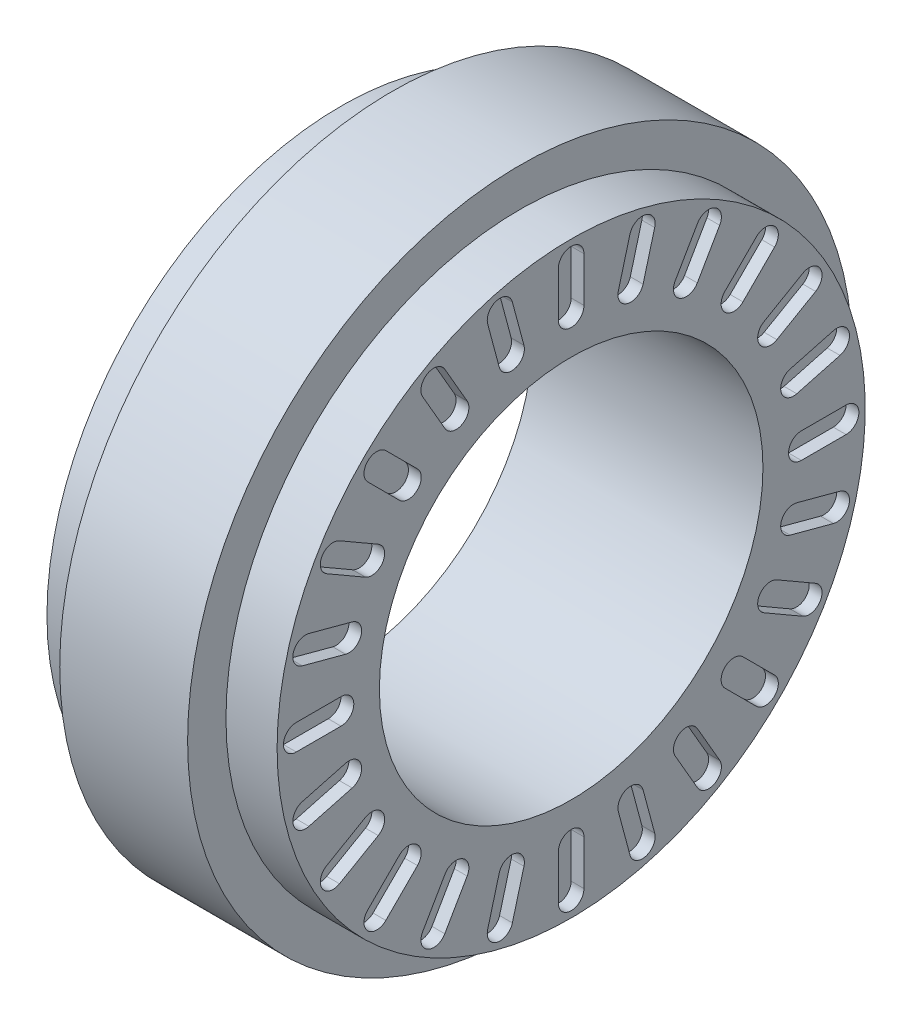
from build123d import *

# Parameters (mm, degrees)
CUT_EXTRUDE1_DEPTH    = 1
CIRPATTERN1_COUNT     = 24
MIRROR4_COPY_1_DEPTH  = 1
MIRROR4_COPY_2_DEPTH  = 1
MIRROR4_COPY_3_DEPTH  = 1
MIRROR4_COPY_4_DEPTH  = 1
MIRROR4_COPY_5_DEPTH  = 1
MIRROR4_COPY_6_DEPTH  = 1
MIRROR4_COPY_7_DEPTH  = 1
MIRROR4_COPY_8_DEPTH  = 1
MIRROR4_COPY_9_DEPTH  = 1
MIRROR4_COPY_10_DEPTH = 1
MIRROR4_COPY_11_DEPTH = 1
MIRROR4_COPY_12_DEPTH = 1
MIRROR4_COPY_13_DEPTH = 1
MIRROR4_COPY_14_DEPTH = 1
MIRROR4_COPY_15_DEPTH = 1
MIRROR4_COPY_16_DEPTH = 1
MIRROR4_COPY_17_DEPTH = 1
MIRROR4_COPY_18_DEPTH = 1
MIRROR4_COPY_19_DEPTH = 1
MIRROR4_COPY_20_DEPTH = 1
MIRROR4_COPY_21_DEPTH = 1
MIRROR4_COPY_22_DEPTH = 1
MIRROR4_COPY_23_DEPTH = 1


with BuildPart() as part:
    # Sketch3 → Revolve1 (revolve)
    with BuildSketch(Plane(origin=(0, 0, 0), x_dir=(1, 0, 0), z_dir=(0, 1, 0)), mode=Mode.PRIVATE) as revolve1_sk:
        Polygon((0, 15), (0, 26), (5, 26), (5, 23), (9, 23), (9, 15), align=None)
    revolve1 = revolve(revolve1_sk.sketch.rotate(Axis((0, 0, 0), (1, 0, 0)), 180), axis=Axis((0, 0, 0), (1, 0, 0)))

    # Mirror3: Revolve1 across plane
    add(revolve1.mirror(Plane(origin=(0, 0, -15), x_dir=(0, 0, 1), z_dir=(1, 0, 0))))

    # Sketch4 → Cut-Extrude1 (cut)
    with BuildSketch(Plane(origin=(9, 0, 0), x_dir=(0, 0, -1), z_dir=(1, 0, 0))):
        with BuildLine():
            Line((-1, 21.5), (-1, 18))
            ThreePointArc((-1, 18), (0, 17), (1, 18))
            Line((1, 18), (1, 21.5))
            ThreePointArc((1, 21.5), (0, 22.5), (-1, 21.5))
        make_face()
    cut_extrude1 = extrude(amount=-CUT_EXTRUDE1_DEPTH, mode=Mode.SUBTRACT)

    # CirPattern1: Cut-Extrude1 ×24 about axis
    cirpattern1_axis = Axis((0, 0, 0), (1, 0, 0))
    for i in range(1, CIRPATTERN1_COUNT):
        add(cut_extrude1.rotate(cirpattern1_axis, i * 360 / CIRPATTERN1_COUNT), mode=Mode.SUBTRACT)

    # Mirror4: Cut-Extrude1 across plane
    add(cut_extrude1.mirror(Plane(origin=(0, 0, 0), x_dir=(0, 0, 1), z_dir=(1, 0, 0))), mode=Mode.SUBTRACT)

    # Mirror4 copy 1 sketch → Mirror4 copy 1 (cut)
    with BuildSketch(Plane(origin=(-9, 0, 0), x_dir=(0, 0.25881904510252074, -0.9659258262890683), z_dir=(-1, 0, 0))):
        with BuildLine():
            Line((-1, -21.5), (-1, -18))
            ThreePointArc((-1, -18), (0, -17), (1, -18))
            Line((1, -18), (1, -21.5))
            ThreePointArc((1, -21.5), (0, -22.5), (-1, -21.5))
        make_face()
    extrude(amount=-MIRROR4_COPY_1_DEPTH, mode=Mode.SUBTRACT)

    # Mirror4 copy 2 sketch → Mirror4 copy 2 (cut)
    with BuildSketch(Plane(origin=(-9, 0, 0), x_dir=(0, 0.49999999999999994, -0.8660254037844387), z_dir=(-1, 0, 0))):
        with BuildLine():
            Line((-1, -21.5), (-1, -18))
            ThreePointArc((-1, -18), (0, -17), (1, -18))
            Line((1, -18), (1, -21.5))
            ThreePointArc((1, -21.5), (0, -22.5), (-1, -21.5))
        make_face()
    extrude(amount=-MIRROR4_COPY_2_DEPTH, mode=Mode.SUBTRACT)

    # Mirror4 copy 3 sketch → Mirror4 copy 3 (cut)
    with BuildSketch(Plane(origin=(-9, 0, 0), x_dir=(0, 0.7071067811865475, -0.7071067811865476), z_dir=(-1, 0, 0))):
        with BuildLine():
            Line((-1, -21.5), (-1, -18))
            ThreePointArc((-1, -18), (0, -17), (1, -18))
            Line((1, -18), (1, -21.5))
            ThreePointArc((1, -21.5), (0, -22.5), (-1, -21.5))
        make_face()
    extrude(amount=-MIRROR4_COPY_3_DEPTH, mode=Mode.SUBTRACT)

    # Mirror4 copy 4 sketch → Mirror4 copy 4 (cut)
    with BuildSketch(Plane(origin=(-9, 0, 0), x_dir=(0, 0.8660254037844386, -0.5000000000000001), z_dir=(-1, 0, 0))):
        with BuildLine():
            Line((-1, -21.5), (-1, -18))
            ThreePointArc((-1, -18), (0, -17), (1, -18))
            Line((1, -18), (1, -21.5))
            ThreePointArc((1, -21.5), (0, -22.5), (-1, -21.5))
        make_face()
    extrude(amount=-MIRROR4_COPY_4_DEPTH, mode=Mode.SUBTRACT)

    # Mirror4 copy 5 sketch → Mirror4 copy 5 (cut)
    with BuildSketch(Plane(origin=(-9, 0, 0), x_dir=(0, 0.9659258262890683, -0.25881904510252074), z_dir=(-1, 0, 0))):
        with BuildLine():
            Line((-1, -21.5), (-1, -18))
            ThreePointArc((-1, -18), (0, -17), (1, -18))
            Line((1, -18), (1, -21.5))
            ThreePointArc((1, -21.5), (0, -22.5), (-1, -21.5))
        make_face()
    extrude(amount=-MIRROR4_COPY_5_DEPTH, mode=Mode.SUBTRACT)

    # Mirror4 copy 6 sketch → Mirror4 copy 6 (cut)
    with BuildSketch(Plane(origin=(-9, 0, 0), x_dir=(0, 1, 0), z_dir=(-1, 0, 0))):
        with BuildLine():
            Line((-1, -21.5), (-1, -18))
            ThreePointArc((-1, -18), (0, -17), (1, -18))
            Line((1, -18), (1, -21.5))
            ThreePointArc((1, -21.5), (0, -22.5), (-1, -21.5))
        make_face()
    extrude(amount=-MIRROR4_COPY_6_DEPTH, mode=Mode.SUBTRACT)

    # Mirror4 copy 7 sketch → Mirror4 copy 7 (cut)
    with BuildSketch(Plane(origin=(-9, 0, 0), x_dir=(0, 0.9659258262890683, 0.25881904510252085), z_dir=(-1, 0, 0))):
        with BuildLine():
            Line((-1, -21.5), (-1, -18))
            ThreePointArc((-1, -18), (0, -17), (1, -18))
            Line((1, -18), (1, -21.5))
            ThreePointArc((1, -21.5), (0, -22.5), (-1, -21.5))
        make_face()
    extrude(amount=-MIRROR4_COPY_7_DEPTH, mode=Mode.SUBTRACT)

    # Mirror4 copy 8 sketch → Mirror4 copy 8 (cut)
    with BuildSketch(Plane(origin=(-9, 0, 0), x_dir=(0, 0.8660254037844387, 0.4999999999999998), z_dir=(-1, 0, 0))):
        with BuildLine():
            Line((-1, -21.5), (-1, -18))
            ThreePointArc((-1, -18), (0, -17), (1, -18))
            Line((1, -18), (1, -21.5))
            ThreePointArc((1, -21.5), (0, -22.5), (-1, -21.5))
        make_face()
    extrude(amount=-MIRROR4_COPY_8_DEPTH, mode=Mode.SUBTRACT)

    # Mirror4 copy 9 sketch → Mirror4 copy 9 (cut)
    with BuildSketch(Plane(origin=(-9, 0, 0), x_dir=(0, 0.7071067811865476, 0.7071067811865475), z_dir=(-1, 0, 0))):
        with BuildLine():
            Line((-1, -21.5), (-1, -18))
            ThreePointArc((-1, -18), (0, -17), (1, -18))
            Line((1, -18), (1, -21.5))
            ThreePointArc((1, -21.5), (0, -22.5), (-1, -21.5))
        make_face()
    extrude(amount=-MIRROR4_COPY_9_DEPTH, mode=Mode.SUBTRACT)

    # Mirror4 copy 10 sketch → Mirror4 copy 10 (cut)
    with BuildSketch(Plane(origin=(-9, 0, 0), x_dir=(0, 0.49999999999999994, 0.8660254037844387), z_dir=(-1, 0, 0))):
        with BuildLine():
            Line((-1, -21.5), (-1, -18))
            ThreePointArc((-1, -18), (0, -17), (1, -18))
            Line((1, -18), (1, -21.5))
            ThreePointArc((1, -21.5), (0, -22.5), (-1, -21.5))
        make_face()
    extrude(amount=-MIRROR4_COPY_10_DEPTH, mode=Mode.SUBTRACT)

    # Mirror4 copy 11 sketch → Mirror4 copy 11 (cut)
    with BuildSketch(Plane(origin=(-9, 0, 0), x_dir=(0, 0.258819045102521, 0.9659258262890682), z_dir=(-1, 0, 0))):
        with BuildLine():
            Line((-1, -21.5), (-1, -18))
            ThreePointArc((-1, -18), (0, -17), (1, -18))
            Line((1, -18), (1, -21.5))
            ThreePointArc((1, -21.5), (0, -22.5), (-1, -21.5))
        make_face()
    extrude(amount=-MIRROR4_COPY_11_DEPTH, mode=Mode.SUBTRACT)

    # Mirror4 copy 12 sketch → Mirror4 copy 12 (cut)
    with BuildSketch(Plane.ZY.offset(9)):
        with BuildLine():
            Line((-1, -21.5), (-1, -18))
            ThreePointArc((-1, -18), (0, -17), (1, -18))
            Line((1, -18), (1, -21.5))
            ThreePointArc((1, -21.5), (0, -22.5), (-1, -21.5))
        make_face()
    extrude(amount=-MIRROR4_COPY_12_DEPTH, mode=Mode.SUBTRACT)

    # Mirror4 copy 13 sketch → Mirror4 copy 13 (cut)
    with BuildSketch(Plane(origin=(-9, 0, 0), x_dir=(0, -0.2588190451025208, 0.9659258262890683), z_dir=(-1, 0, 0))):
        with BuildLine():
            Line((-1, -21.5), (-1, -18))
            ThreePointArc((-1, -18), (0, -17), (1, -18))
            Line((1, -18), (1, -21.5))
            ThreePointArc((1, -21.5), (0, -22.5), (-1, -21.5))
        make_face()
    extrude(amount=-MIRROR4_COPY_13_DEPTH, mode=Mode.SUBTRACT)

    # Mirror4 copy 14 sketch → Mirror4 copy 14 (cut)
    with BuildSketch(Plane(origin=(-9, 0, 0), x_dir=(0, -0.5000000000000001, 0.8660254037844386), z_dir=(-1, 0, 0))):
        with BuildLine():
            Line((-1, -21.5), (-1, -18))
            ThreePointArc((-1, -18), (0, -17), (1, -18))
            Line((1, -18), (1, -21.5))
            ThreePointArc((1, -21.5), (0, -22.5), (-1, -21.5))
        make_face()
    extrude(amount=-MIRROR4_COPY_14_DEPTH, mode=Mode.SUBTRACT)

    # Mirror4 copy 15 sketch → Mirror4 copy 15 (cut)
    with BuildSketch(Plane(origin=(-9, 0, 0), x_dir=(0, -0.7071067811865475, 0.7071067811865477), z_dir=(-1, 0, 0))):
        with BuildLine():
            Line((-1, -21.5), (-1, -18))
            ThreePointArc((-1, -18), (0, -17), (1, -18))
            Line((1, -18), (1, -21.5))
            ThreePointArc((1, -21.5), (0, -22.5), (-1, -21.5))
        make_face()
    extrude(amount=-MIRROR4_COPY_15_DEPTH, mode=Mode.SUBTRACT)

    # Mirror4 copy 16 sketch → Mirror4 copy 16 (cut)
    with BuildSketch(Plane(origin=(-9, 0, 0), x_dir=(0, -0.8660254037844384, 0.5000000000000004), z_dir=(-1, 0, 0))):
        with BuildLine():
            Line((-1, -21.5), (-1, -18))
            ThreePointArc((-1, -18), (0, -17), (1, -18))
            Line((1, -18), (1, -21.5))
            ThreePointArc((1, -21.5), (0, -22.5), (-1, -21.5))
        make_face()
    extrude(amount=-MIRROR4_COPY_16_DEPTH, mode=Mode.SUBTRACT)

    # Mirror4 copy 17 sketch → Mirror4 copy 17 (cut)
    with BuildSketch(Plane(origin=(-9, 0, 0), x_dir=(0, -0.9659258262890683, 0.25881904510252063), z_dir=(-1, 0, 0))):
        with BuildLine():
            Line((-1, -21.5), (-1, -18))
            ThreePointArc((-1, -18), (0, -17), (1, -18))
            Line((1, -18), (1, -21.5))
            ThreePointArc((1, -21.5), (0, -22.5), (-1, -21.5))
        make_face()
    extrude(amount=-MIRROR4_COPY_17_DEPTH, mode=Mode.SUBTRACT)

    # Mirror4 copy 18 sketch → Mirror4 copy 18 (cut)
    with BuildSketch(Plane(origin=(-9, 0, 0), x_dir=(0, -1, 0), z_dir=(-1, 0, 0))):
        with BuildLine():
            Line((-1, -21.5), (-1, -18))
            ThreePointArc((-1, -18), (0, -17), (1, -18))
            Line((1, -18), (1, -21.5))
            ThreePointArc((1, -21.5), (0, -22.5), (-1, -21.5))
        make_face()
    extrude(amount=-MIRROR4_COPY_18_DEPTH, mode=Mode.SUBTRACT)

    # Mirror4 copy 19 sketch → Mirror4 copy 19 (cut)
    with BuildSketch(Plane(origin=(-9, 0, 0), x_dir=(0, -0.9659258262890684, -0.2588190451025203), z_dir=(-1, 0, 0))):
        with BuildLine():
            Line((-1, -21.5), (-1, -18))
            ThreePointArc((-1, -18), (0, -17), (1, -18))
            Line((1, -18), (1, -21.5))
            ThreePointArc((1, -21.5), (0, -22.5), (-1, -21.5))
        make_face()
    extrude(amount=-MIRROR4_COPY_19_DEPTH, mode=Mode.SUBTRACT)

    # Mirror4 copy 20 sketch → Mirror4 copy 20 (cut)
    with BuildSketch(Plane(origin=(-9, 0, 0), x_dir=(0, -0.8660254037844386, -0.5000000000000001), z_dir=(-1, 0, 0))):
        with BuildLine():
            Line((-1, -21.5), (-1, -18))
            ThreePointArc((-1, -18), (0, -17), (1, -18))
            Line((1, -18), (1, -21.5))
            ThreePointArc((1, -21.5), (0, -22.5), (-1, -21.5))
        make_face()
    extrude(amount=-MIRROR4_COPY_20_DEPTH, mode=Mode.SUBTRACT)

    # Mirror4 copy 21 sketch → Mirror4 copy 21 (cut)
    with BuildSketch(Plane(origin=(-9, 0, 0), x_dir=(0, -0.7071067811865477, -0.7071067811865474), z_dir=(-1, 0, 0))):
        with BuildLine():
            Line((-1, -21.5), (-1, -18))
            ThreePointArc((-1, -18), (0, -17), (1, -18))
            Line((1, -18), (1, -21.5))
            ThreePointArc((1, -21.5), (0, -22.5), (-1, -21.5))
        make_face()
    extrude(amount=-MIRROR4_COPY_21_DEPTH, mode=Mode.SUBTRACT)

    # Mirror4 copy 22 sketch → Mirror4 copy 22 (cut)
    with BuildSketch(Plane(origin=(-9, 0, 0), x_dir=(0, -0.5000000000000004, -0.8660254037844384), z_dir=(-1, 0, 0))):
        with BuildLine():
            Line((-1, -21.5), (-1, -18))
            ThreePointArc((-1, -18), (0, -17), (1, -18))
            Line((1, -18), (1, -21.5))
            ThreePointArc((1, -21.5), (0, -22.5), (-1, -21.5))
        make_face()
    extrude(amount=-MIRROR4_COPY_22_DEPTH, mode=Mode.SUBTRACT)

    # Mirror4 copy 23 sketch → Mirror4 copy 23 (cut)
    with BuildSketch(Plane(origin=(-9, 0, 0), x_dir=(0, -0.2588190451025207, -0.9659258262890683), z_dir=(-1, 0, 0))):
        with BuildLine():
            Line((-1, -21.5), (-1, -18))
            ThreePointArc((-1, -18), (0, -17), (1, -18))
            Line((1, -18), (1, -21.5))
            ThreePointArc((1, -21.5), (0, -22.5), (-1, -21.5))
        make_face()
    extrude(amount=-MIRROR4_COPY_23_DEPTH, mode=Mode.SUBTRACT)


solid = part.part
